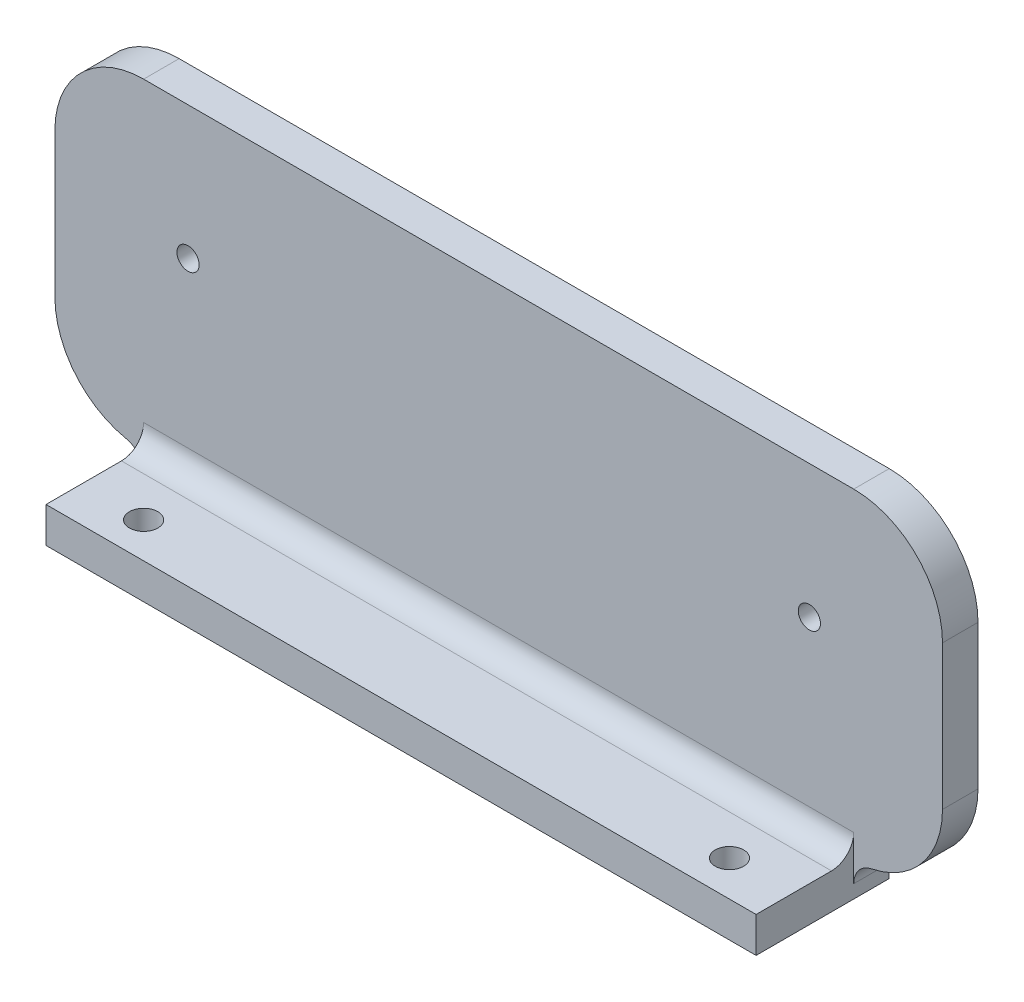
from build123d import *

# Parameters (mm, degrees)
SKETCH1_W           = 100
SKETCH1_H           = 36
BOSS_EXTRUDE1_DEPTH = 4
SKETCH5_W           = 80
SKETCH5_H           = 15
BOSS_EXTRUDE3_DEPTH = 4
SKETCH6_R           = 1.25
CUT_EXTRUDE3_DEPTH  = 56.722526863
FILLET3_R           = 2.5
FILLET4_R           = 2.5
FILLET5_R           = 10
SKETCH7_R           = 1.6
CUT_EXTRUDE4_DEPTH  = 4


with BuildPart() as part:
    # Sketch1 → Boss-Extrude1 (new body)
    with BuildSketch(Plane.XY):
        Rectangle(SKETCH1_W, SKETCH1_H)
    extrude(amount=BOSS_EXTRUDE1_DEPTH)

    # Sketch5 → Boss-Extrude3 (add)
    with BuildSketch(Plane.XZ.offset(18)):
        with Locations((0, 7.5)):
            Rectangle(SKETCH5_W, SKETCH5_H)
    extrude(amount=BOSS_EXTRUDE3_DEPTH)

    # Sketch6 → Cut-Extrude3 (cut, through all)
    with BuildSketch(Plane.XY.offset(4)):
        with Locations((35, 3)):
            Circle(SKETCH6_R)
        with Locations((-35, 3)):
            Circle(SKETCH6_R)
    extrude(amount=-CUT_EXTRUDE3_DEPTH, mode=Mode.SUBTRACT)

    # Fillet3
    fillet3_edges = [part.edges().sort_by_distance(p)[0] for p in [
        (0, -18, 4),
    ]]
    fillet(fillet3_edges, radius=FILLET3_R)

    # Fillet4
    fillet4_edges = [part.edges().sort_by_distance(p)[0] for p in [
        (-40, -18, 2),
        (40, -18, 2),
    ]]
    fillet(fillet4_edges, radius=FILLET4_R)

    # Fillet5
    fillet5_edges = [part.edges().sort_by_distance(p)[0] for p in [
        (-50, -18, 2),
        (50, -18, 2),
        (-50, 18, 2),
        (50, 18, 2),
    ]]
    fillet(fillet5_edges, radius=FILLET5_R)

    # Sketch7 → Cut-Extrude4 (cut)
    with BuildSketch(Plane.XZ.offset(22)):
        with Locations(Location((33, 11, 0), (0, 0, 270))):
            Circle(SKETCH7_R)
        with Locations(Location((-33, 11, 0), (0, 0, 270))):
            Circle(SKETCH7_R)
    extrude(amount=-CUT_EXTRUDE4_DEPTH, mode=Mode.SUBTRACT)


solid = part.part
